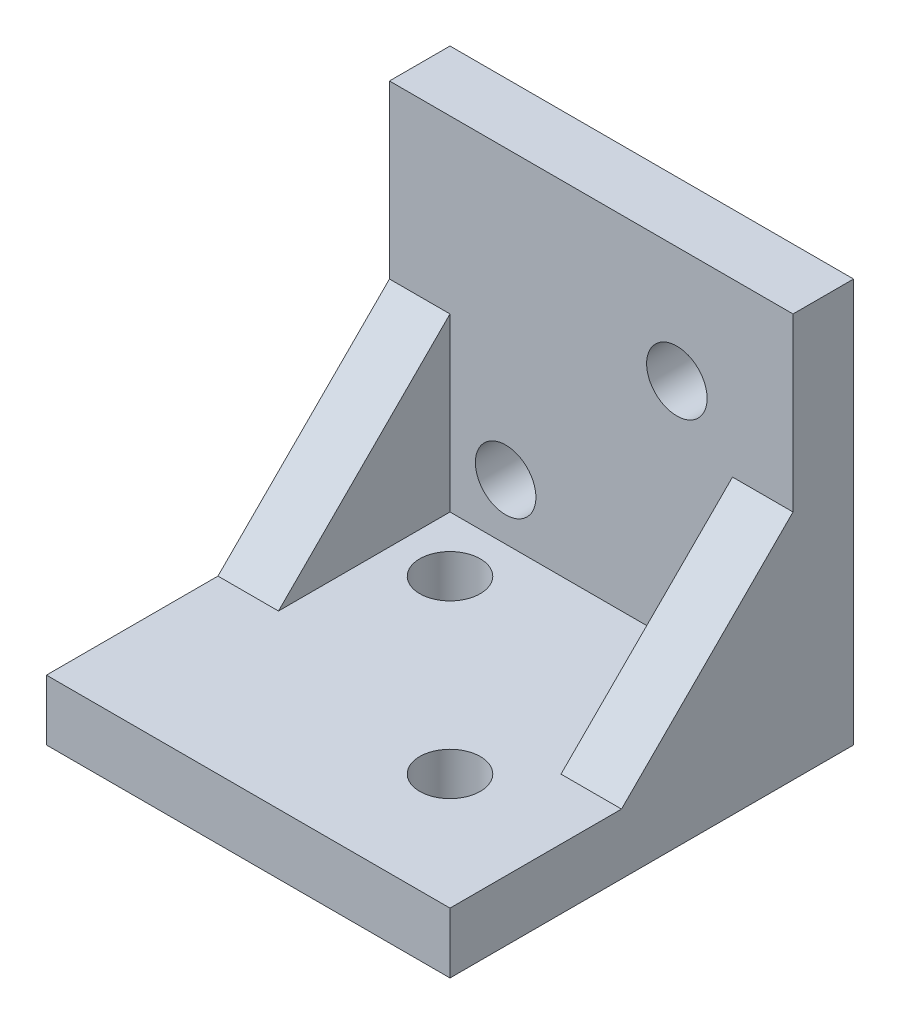
from build123d import *

# Parameters (mm, degrees)
SKETCH1_W           = 20
SKETCH1_H           = 20
SKETCH1_R           = 1.5
BOSS_EXTRUDE1_DEPTH = 3
SKETCH2_W           = 20
SKETCH2_H           = 3
BOSS_EXTRUDE2_DEPTH = 17
SKETCH3_R           = 1.5
CUT_EXTRUDE1_DEPTH  = 30
BOSS_EXTRUDE3_DEPTH = 3
BOSS_EXTRUDE4_START = -20
BOSS_EXTRUDE4_DEPTH = 3


with BuildPart() as part:
    # Sketch1 → Boss-Extrude1 (new body)
    with BuildSketch(Plane(origin=(0, 0, 0), x_dir=(1, 0, 0), z_dir=(0, 1, 0))):
        Rectangle(SKETCH1_W, SKETCH1_H)
        with Locations(Location((-4.242640687, 4.242640687, 0), (0, 0, 270))):
            Circle(SKETCH1_R, mode=Mode.SUBTRACT)
        with Locations(Location((4.242640687, -4.242640687, 0), (0, 0, 270))):
            Circle(SKETCH1_R, mode=Mode.SUBTRACT)
    extrude(amount=BOSS_EXTRUDE1_DEPTH)

    # Sketch2 → Boss-Extrude2 (add)
    with BuildSketch(Plane(origin=(0, 3, 0), x_dir=(1, 0, 0), z_dir=(0, 1, 0))):
        with Locations((0, 8.5)):
            Rectangle(SKETCH2_W, SKETCH2_H)
    extrude(amount=BOSS_EXTRUDE2_DEPTH)

    # Sketch3 → Cut-Extrude1 (cut)
    with BuildSketch(Plane(origin=(0, 0, -10), x_dir=(-1, 0, 0), z_dir=(0, 0, -1))):
        with Locations((-4.242640687, 14.242640687)):
            Circle(SKETCH3_R)
        with Locations((4.242640687, 5.757359313)):
            Circle(SKETCH3_R)
    extrude(amount=-CUT_EXTRUDE1_DEPTH, mode=Mode.SUBTRACT)

    # Sketch4 → Boss-Extrude3 (add)
    with BuildSketch(Plane.ZY.offset(10)):
        Polygon((-7, 11.5), (1.5, 3), (-7, 3), align=None)
    extrude(amount=-BOSS_EXTRUDE3_DEPTH)

    # Sketch4<2> → Boss-Extrude4 (add)
    with BuildSketch(Plane.ZY.offset(10).offset(BOSS_EXTRUDE4_START)):
        Polygon((-7, 11.5), (1.5, 3), (-7, 3), align=None)
    extrude(amount=BOSS_EXTRUDE4_DEPTH)


solid = part.part
